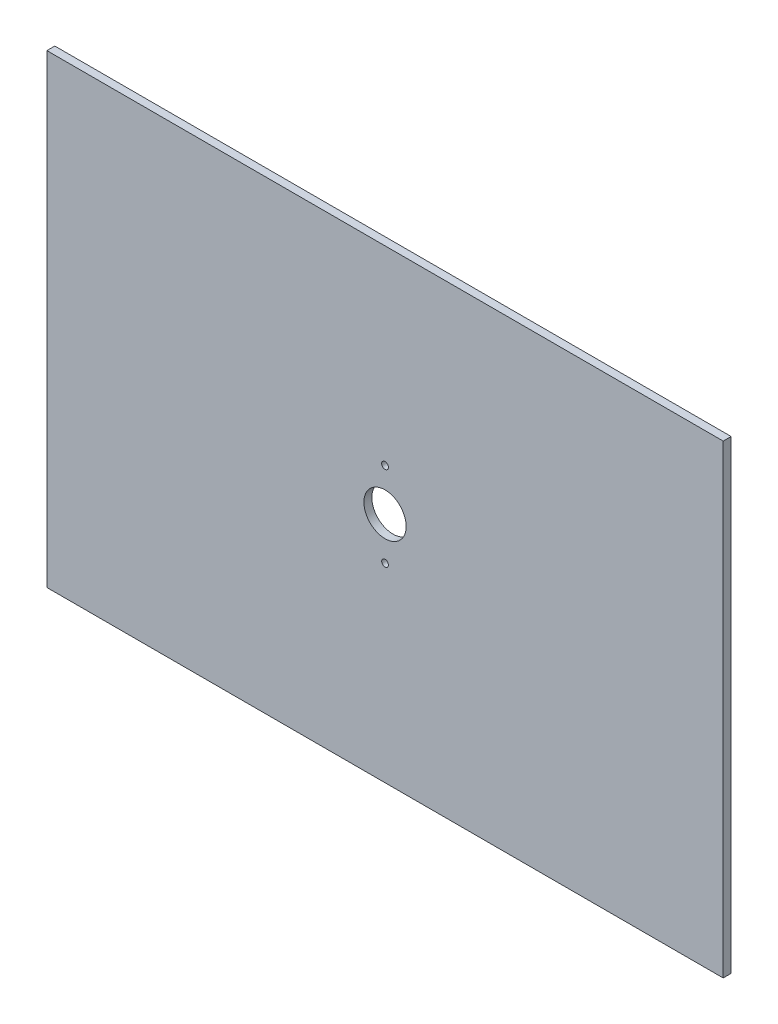
from build123d import *

# Parameters (mm, degrees)
SKETCH1_W           = 406.4
SKETCH1_H           = 279.4
BOSS_EXTRUDE1_DEPTH = 4.7625
SKETCH2_R           = 12.7
CUT_EXTRUDE1_DEPTH  = 4.7625
SKETCH3_R           = 2.032
CUT_EXTRUDE2_DEPTH  = 4.7625


with BuildPart() as part:
    # Sketch1 → Boss-Extrude1 (new body)
    with BuildSketch(Plane.XY):
        with Locations((-203.2, 139.7)):
            Rectangle(SKETCH1_W, SKETCH1_H)
    extrude(amount=BOSS_EXTRUDE1_DEPTH)

    # Sketch2 → Cut-Extrude1 (cut)
    with BuildSketch(Plane.XY.offset(4.7625)):
        with Locations((-203.2, 139.7)):
            Circle(SKETCH2_R)
    extrude(amount=-CUT_EXTRUDE1_DEPTH, mode=Mode.SUBTRACT)

    # Sketch3 → Cut-Extrude2 (cut)
    with BuildSketch(Plane(origin=(0, 0, 0), x_dir=(-1, 0, 0), z_dir=(0, 0, -1))):
        with Locations((203.2, 114.3)):
            Circle(SKETCH3_R)
        with Locations((203.2, 165.1)):
            Circle(SKETCH3_R)
    extrude(amount=-CUT_EXTRUDE2_DEPTH, mode=Mode.SUBTRACT)


solid = part.part
